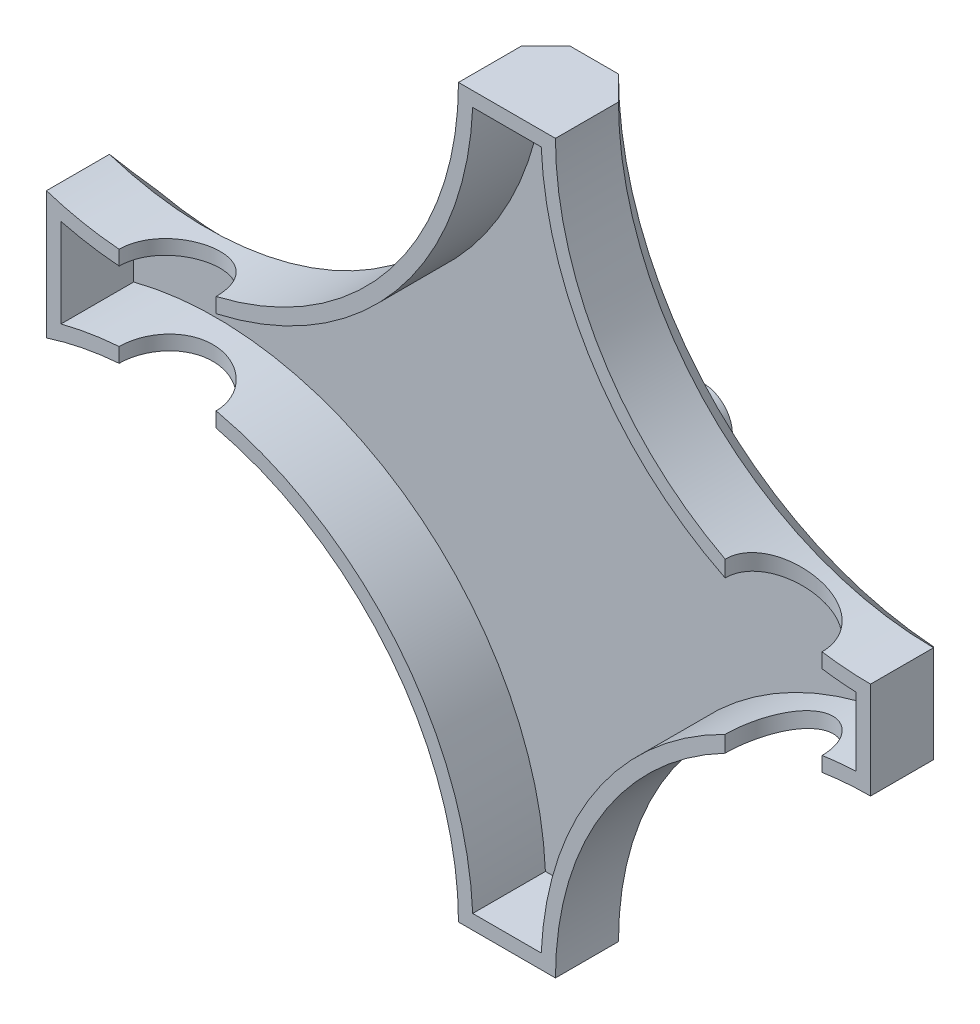
from build123d import *

# Parameters (mm, degrees)
SKETCH1_W               = 170
SKETCH1_H               = 150
BOSS_EXTRUDE1_DEPTH     = 18
SKETCH2_R               = 65
CUT_EXTRUDE1_DEPTH      = 20
SHELL2_T                = -3
CUT_EXTRUDE2_DEPTH      = 20
CUT_EXTRUDE2_DEPTH_BACK = 20
SKETCH3_R               = 10
SKETCH4_R               = 2.5
CUT_EXTRUDE3_DEPTH      = 20
CHAMFER1_SIZE           = 5
SKETCH5_R               = 6
BOSS_EXTRUDE2_DEPTH     = 10


with BuildPart() as part:
    # Sketch1 → Boss-Extrude1 (new body)
    with BuildSketch(Plane.XY):
        Rectangle(SKETCH1_W, SKETCH1_H)
    extrude(amount=BOSS_EXTRUDE1_DEPTH)

    # Sketch2 → Cut-Extrude1 (cut)
    with BuildSketch(Plane(origin=(0, 0, 0), x_dir=(-1, 0, 0), z_dir=(0, 0, -1))):
        with Locations((-85, 75)):
            Circle(SKETCH2_R)
        with Locations((-85, -75)):
            Circle(SKETCH2_R)
        with Locations((65, 75)):
            Circle(SKETCH2_R)
        with Locations((65, -75)):
            Circle(SKETCH2_R)
    extrude(amount=-CUT_EXTRUDE1_DEPTH, mode=Mode.SUBTRACT)

    # Shell2
    shell2_openings = [part.faces().sort_by_distance(p)[0] for p in [
        (6.095773298, 0, 18),
    ]]
    offset(amount=SHELL2_T, openings=shell2_openings, kind=Kind.INTERSECTION)

    # Sketch3 → Cut-Extrude2 (cut, two sides: drawn at the far end of the back side and taken through both)
    with BuildSketch(Plane(origin=(0, 0, 0), x_dir=(1, 0, 0), z_dir=(0, 1, 0)).offset(-CUT_EXTRUDE2_DEPTH_BACK)):
        with Locations((-60, -18)):
            Circle(SKETCH3_R)
        with Locations((65, -18)):
            Circle(SKETCH3_R)
    extrude(amount=CUT_EXTRUDE2_DEPTH + CUT_EXTRUDE2_DEPTH_BACK, mode=Mode.SUBTRACT)

    # Sketch4 → Cut-Extrude3 (cut)
    with BuildSketch(Plane(origin=(0, 0, 0), x_dir=(-1, 0, 0), z_dir=(0, 0, -1))):
        with Locations((-10, -67)):
            Circle(SKETCH4_R)
        with Locations((-10, 67)):
            Circle(SKETCH4_R)
    extrude(amount=-CUT_EXTRUDE3_DEPTH, mode=Mode.SUBTRACT)

    # Chamfer1
    chamfer1_edges = [part.edges().sort_by_distance(p)[0] for p in [
        (-85, 0, 0),
        (85, 0, 0),
        (39.038059223, 29.038059223, 0),
        (39.038059223, -29.038059223, 0),
        (-26.757353648, 22.440509896, 0),
        (-26.757353648, -22.440509896, 0),
    ]]
    chamfer(chamfer1_edges, length=CHAMFER1_SIZE)

    # Sketch5 → Boss-Extrude2 (add)
    with BuildSketch(Plane(origin=(0, 0, 0), x_dir=(-1, 0, 0), z_dir=(0, 0, -1))):
        with Locations(Location((-22.5, 12.5, 0), (0, 0, 180))):
            Circle(SKETCH5_R)
        with Locations(Location((2.5, 12.5, 0), (0, 0, 180))):
            Circle(SKETCH5_R)
        with Locations(Location((2.5, -12.5, 0), (0, 0, 180))):
            Circle(SKETCH5_R)
        with Locations(Location((-22.5, -12.5, 0), (0, 0, 180))):
            Circle(SKETCH5_R)
    extrude(amount=BOSS_EXTRUDE2_DEPTH)


solid = part.part
